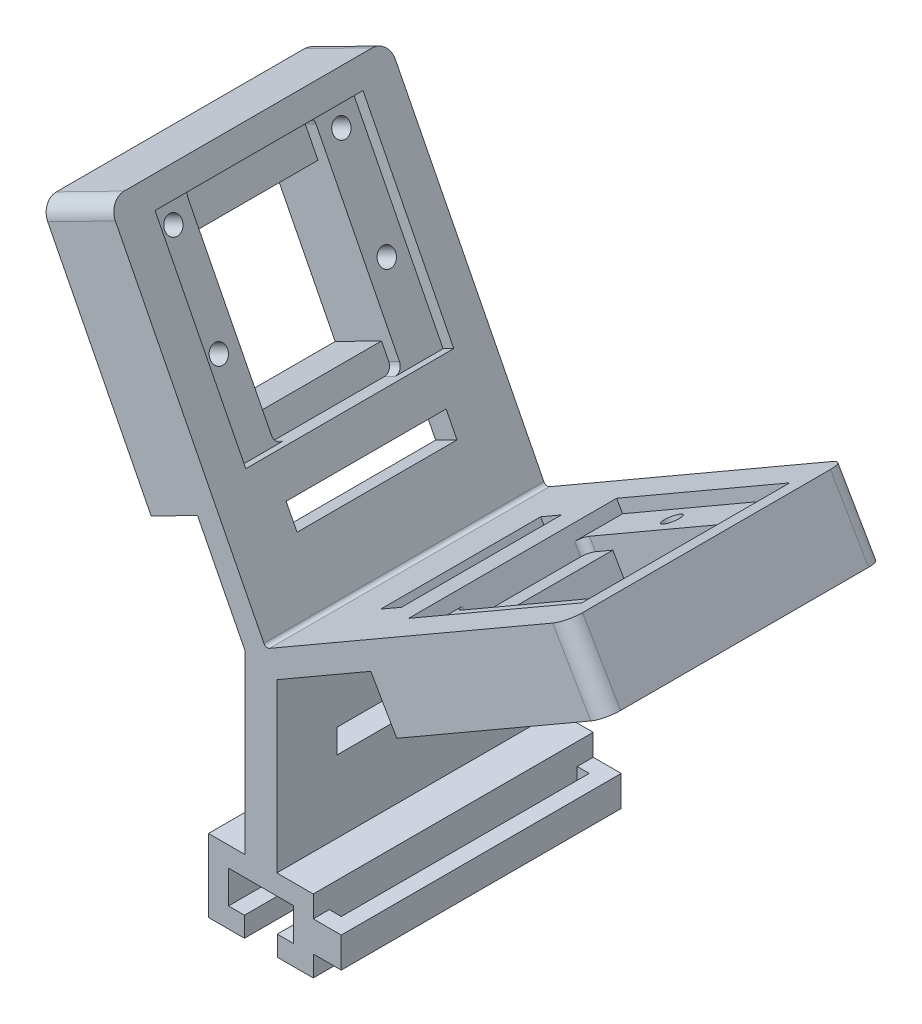
from build123d import *

# Parameters (mm, degrees)
BOSS_EXTRUDE1_DEPTH      = 35
BOSS_EXTRUDE2_DEPTH      = 35
FILLET1_R                = 0.5
SKETCH3_W                = 26
SKETCH3_H                = 25
CUT_EXTRUDE1_DEPTH       = 1.5
SKETCH4_W                = 16
SKETCH4_H                = 25
CUT_EXTRUDE2_DEPTH       = 2
FILLET3_R                = 1
SKETCH5_W                = 26
SKETCH5_H                = 25
CUT_EXTRUDE3_DEPTH       = 1.5
SKETCH6_W                = 16
SKETCH6_H                = 25
CUT_EXTRUDE4_DEPTH       = 2
FILLET4_R                = 1
SKETCH8_W                = 20
SKETCH8_H                = 3
CUT_EXTRUDE5_DEPTH       = 4
SKETCH9_W                = 20
SKETCH9_H                = 3
CUT_EXTRUDE6_DEPTH       = 4
SKETCH10_W               = 20
SKETCH10_H               = 3
CUT_EXTRUDE7_DEPTH       = 4
SKETCH11_R               = 1.1
CUT_EXTRUDE8_DEPTH       = 10
SKETCH12_R               = 1.1
CUT_EXTRUDE9_DEPTH       = 5
FILLET7_R                = 2
BOSS_EXTRUDE3_DEPTH      = 3.5
BOSS_EXTRUDE3_DEPTH_BACK = 1
SKETCH14_W               = 35
SKETCH14_H               = 3.801557548
SKETCH15_W               = 1.5
SKETCH15_H               = 31
CUT_EXTRUDE10_DEPTH      = 5
SKETCH18_R               = 1.1
SKETCH18_W               = 16
SKETCH18_H               = 20
BOSS_EXTRUDE4_DEPTH      = 6.5
SKETCH19_R               = 1.1
SKETCH19_W               = 16
SKETCH19_H               = 17.5
BOSS_EXTRUDE5_DEPTH      = 6.5


with BuildPart() as part:
    # Sketch1 → Boss-Extrude1 (new body)
    with BuildSketch(Plane.XY):
        Polygon((6.55, 4.55), (-6.55, 4.55), (-6.55, -4.55), (-2.05, -4.55), (-2.05, -2.05), (-4.05, -2.05), (-4.05, 2.05), (4.05, 2.05), (4.05, -2.05), (2.05, -2.05), (2.05, -4.55), (6.55, -4.55), align=None)
    extrude(amount=BOSS_EXTRUDE1_DEPTH)

    # Sketch2 → Boss-Extrude2 (add, through all)
    with BuildSketch(Plane.XY.offset(35)):
        Polygon((2, 4.55), (2, 25.472649731), (39.72114317, 47.250961894), (38.22114317, 49.849038106), (0.618900538, 28.1393732), (-19.093062702, 66.826279338), (-21.766082275, 65.464307839), (-2, 26.671187114), (-2, 4.55), align=None)
    extrude(amount=-BOSS_EXTRUDE2_DEPTH)

    # Fillet1
    fillet1_edges = [part.edges().sort_by_distance(p)[0] for p in [
        (0.618900538, 28.1393732, 17.5),
    ]]
    fillet(fillet1_edges, radius=FILLET1_R)

    # Sketch3 → Cut-Extrude1 (cut)
    with BuildSketch(Plane(origin=(-12.029980884, 20.836538106, 0), x_dir=(0, 0, 1), z_dir=(-0.4999999999999978, 0.8660254037844398, 0))):
        with Locations((17.5, 42.525)):
            Rectangle(SKETCH3_W, SKETCH3_H)
    extrude(amount=-CUT_EXTRUDE1_DEPTH, mode=Mode.SUBTRACT)

    # Sketch4 → Cut-Extrude2 (cut)
    with BuildSketch(Plane(origin=(-11.279980884, 19.5375, 0), x_dir=(0, 0, 1), z_dir=(-0.49999999999999795, 0.8660254037844399, 0))):
        with Locations((17.5, 42.525)):
            Rectangle(SKETCH4_W, SKETCH4_H)
    extrude(amount=-CUT_EXTRUDE2_DEPTH, mode=Mode.SUBTRACT)

    # Fillet3
    fillet3_edges = [part.edges().sort_by_distance(p)[0] for p in [
        (36.748066959, 46.400480947, 9.5),
        (36.748066959, 46.400480947, 25.5),
        (15.097431864, 33.900480947, 25.5),
        (15.097431864, 33.900480947, 9.5),
    ]]
    fillet(fillet3_edges, radius=FILLET3_R)

    # Sketch5 → Cut-Extrude3 (cut)
    with BuildSketch(Plane(origin=(11.873956138, 6.050082838, 0), x_dir=(0, 0, -1), z_dir=(0.8910065241883675, 0.45399049973954786, 0))):
        with Locations((-17.5, 52.710719955)):
            Rectangle(SKETCH5_W, SKETCH5_H)
    extrude(amount=-CUT_EXTRUDE3_DEPTH, mode=Mode.SUBTRACT)

    # Sketch6 → Cut-Extrude4 (cut)
    with BuildSketch(Plane(origin=(10.537446352, 5.369097089, 0), x_dir=(0, 0, -1), z_dir=(0.8910065241883673, 0.4539904997395479, 0))):
        with Locations((-17.5, 52.710719955)):
            Rectangle(SKETCH6_W, SKETCH6_H)
    extrude(amount=-CUT_EXTRUDE4_DEPTH, mode=Mode.SUBTRACT)

    # Fillet4
    fillet4_edges = [part.edges().sort_by_distance(p)[0] for p in [
        (-19.735855882, 63.131781141, 25.5),
        (-19.735855882, 63.131781141, 9.5),
        (-8.386093389, 40.856618036, 9.5),
        (-8.386093389, 40.856618036, 25.5),
    ]]
    fillet(fillet4_edges, radius=FILLET4_R)

    # Sketch8 → Cut-Extrude5 (cut)
    with BuildSketch(Plane(origin=(-10.529980884, 18.238461894, 0), x_dir=(0, 0, -1), z_dir=(0.49999999999999806, -0.8660254037844399, 0))):
        with Locations((-17.5, 24.025)):
            Rectangle(SKETCH8_W, SKETCH8_H)
    extrude(amount=-CUT_EXTRUDE5_DEPTH, mode=Mode.SUBTRACT)

    # Sketch9 → Cut-Extrude6 (cut)
    with BuildSketch(Plane(origin=(9.200936565, 4.688111339, 0), x_dir=(0, 0, 1), z_dir=(-0.8910065241883675, -0.45399049973954797, 0))):
        with Locations((17.5, 34.210719955)):
            Rectangle(SKETCH9_W, SKETCH9_H)
    extrude(amount=-CUT_EXTRUDE6_DEPTH, mode=Mode.SUBTRACT)

    # Sketch10 → Cut-Extrude7 (cut)
    with BuildSketch(Plane.ZY.offset(2)):
        with Locations((17.5, 15.062177826)):
            Rectangle(SKETCH10_W, SKETCH10_H)
    extrude(amount=-CUT_EXTRUDE7_DEPTH, mode=Mode.SUBTRACT)

    # Sketch11 → Cut-Extrude8 (cut)
    with BuildSketch(Plane(origin=(-11.279980884, 19.5375, 0), x_dir=(0, 0, 1), z_dir=(-0.4999999999999979, 0.8660254037844398, 0))):
        with Locations(Location((28, 52.525, 0), (0, 0, 270))):
            Circle(SKETCH11_R)
        with Locations(Location((7, 52.525, 0), (0, 0, 270))):
            Circle(SKETCH11_R)
        with Locations(Location((28, 40.025, 0), (0, 0, 270))):
            Circle(SKETCH11_R)
        with Locations(Location((7, 40.025, 0), (0, 0, 270))):
            Circle(SKETCH11_R)
    extrude(amount=-CUT_EXTRUDE8_DEPTH, mode=Mode.SUBTRACT)

    # Sketch12 → Cut-Extrude9 (cut)
    with BuildSketch(Plane(origin=(10.537446352, 5.369097089, 0), x_dir=(0, 0, -1), z_dir=(0.8910065241883673, 0.4539904997395479, 0))):
        with Locations(Location((-7, 62.710719955, 0), (0, 0, 90))):
            Circle(SKETCH12_R)
        with Locations(Location((-28, 62.710719955, 0), (0, 0, 90))):
            Circle(SKETCH12_R)
        with Locations(Location((-7, 50.210719955, 0), (0, 0, 90))):
            Circle(SKETCH12_R)
        with Locations(Location((-28, 50.210719955, 0), (0, 0, 90))):
            Circle(SKETCH12_R)
    extrude(amount=-CUT_EXTRUDE9_DEPTH, mode=Mode.SUBTRACT)

    # Fillet7
    fillet7_edges = [part.edges().sort_by_distance(p)[0] for p in [
        (-20.429572488, 66.145293588, 0),
        (38.97114317, 48.55, 0),
        (38.97114317, 48.55, 35),
        (-20.429572488, 66.145293588, 35),
    ]]
    fillet(fillet7_edges, radius=FILLET7_R)

    # Sketch14 → Boss-Extrude3 (add, two sides: drawn at the far end of the back side and taken through both)
    with BuildSketch(Plane(origin=(6.55, 0, 0), x_dir=(0, 0, -1), z_dir=(1, 0, 0)).offset(-BOSS_EXTRUDE3_DEPTH_BACK)):
        with Locations((-17.5, -0.05)):
            Rectangle(SKETCH14_W, SKETCH14_H)
    extrude(amount=BOSS_EXTRUDE3_DEPTH + BOSS_EXTRUDE3_DEPTH_BACK)

    # Sketch15 → Cut-Extrude10 (cut)
    with BuildSketch(Plane(origin=(0, 1.850778774, 0), x_dir=(1, 0, 0), z_dir=(0, 1, 0))):
        with Locations((7.3, -17.5)):
            Rectangle(SKETCH15_W, SKETCH15_H)
    extrude(amount=-CUT_EXTRUDE10_DEPTH, mode=Mode.SUBTRACT)

    # Sketch18 → Boss-Extrude4 (add)
    with BuildSketch(Plane(origin=(-10.529980884, 18.238461894, 0), x_dir=(0, 0, -1), z_dir=(0.49999999999999806, -0.8660254037844398, 0))):
        with BuildLine():
            Line((-35, 28.025), (-35, 56.025))
            ThreePointArc((-35, 56.025), (-34.414213562, 57.439213562), (-33, 58.025))
            Line((-33, 58.025), (-2, 58.025))
            ThreePointArc((-2, 58.025), (-0.585786438, 57.439213562), (0, 56.025))
            Line((0, 56.025), (0, 28.025))
            Line((0, 28.025), (-35, 28.025))
        make_face()
        with Locations(Location((-7, 52.525, 0), (0, 0, 270))):
            Circle(SKETCH18_R, mode=Mode.SUBTRACT)
        with Locations(Location((-7, 40.025, 0), (0, 0, 270))):
            Circle(SKETCH18_R, mode=Mode.SUBTRACT)
        with Locations(Location((-28, 40.025, 0), (0, 0, 270))):
            Circle(SKETCH18_R, mode=Mode.SUBTRACT)
        with Locations(Location((-28, 52.525, 0), (0, 0, 270))):
            Circle(SKETCH18_R, mode=Mode.SUBTRACT)
        with Locations((-17.5, 43.525)):
            Rectangle(SKETCH18_W, SKETCH18_H, mode=Mode.SUBTRACT)
    extrude(amount=BOSS_EXTRUDE4_DEPTH)

    # Sketch19 → Boss-Extrude5 (add)
    with BuildSketch(Plane(origin=(9.200936565, 4.688111339, 0), x_dir=(0, 0, 1), z_dir=(-0.8910065241883673, -0.45399049973954797, 0))):
        with BuildLine():
            Line((33, 68.210719955), (2, 68.210719955))
            ThreePointArc((2, 68.210719955), (0.585786438, 67.624933517), (0, 66.210719955))
            Line((0, 66.210719955), (0, 37.710719955))
            Line((0, 37.710719955), (35, 37.710719955))
            Line((35, 37.710719955), (35, 66.210719955))
            ThreePointArc((35, 66.210719955), (34.414213562, 67.624933517), (33, 68.210719955))
        make_face()
        with Locations(Location((28, 50.210719955, 0), (0, 0, 90))):
            Circle(SKETCH19_R, mode=Mode.SUBTRACT)
        with Locations(Location((7, 50.210719955, 0), (0, 0, 90))):
            Circle(SKETCH19_R, mode=Mode.SUBTRACT)
        with Locations(Location((7, 62.710719955, 0), (0, 0, 90))):
            Circle(SKETCH19_R, mode=Mode.SUBTRACT)
        with Locations(Location((28, 62.710719955, 0), (0, 0, 90))):
            Circle(SKETCH19_R, mode=Mode.SUBTRACT)
        with Locations((17.5, 51.960719955)):
            Rectangle(SKETCH19_W, SKETCH19_H, mode=Mode.SUBTRACT)
    extrude(amount=BOSS_EXTRUDE5_DEPTH)


solid = part.part
